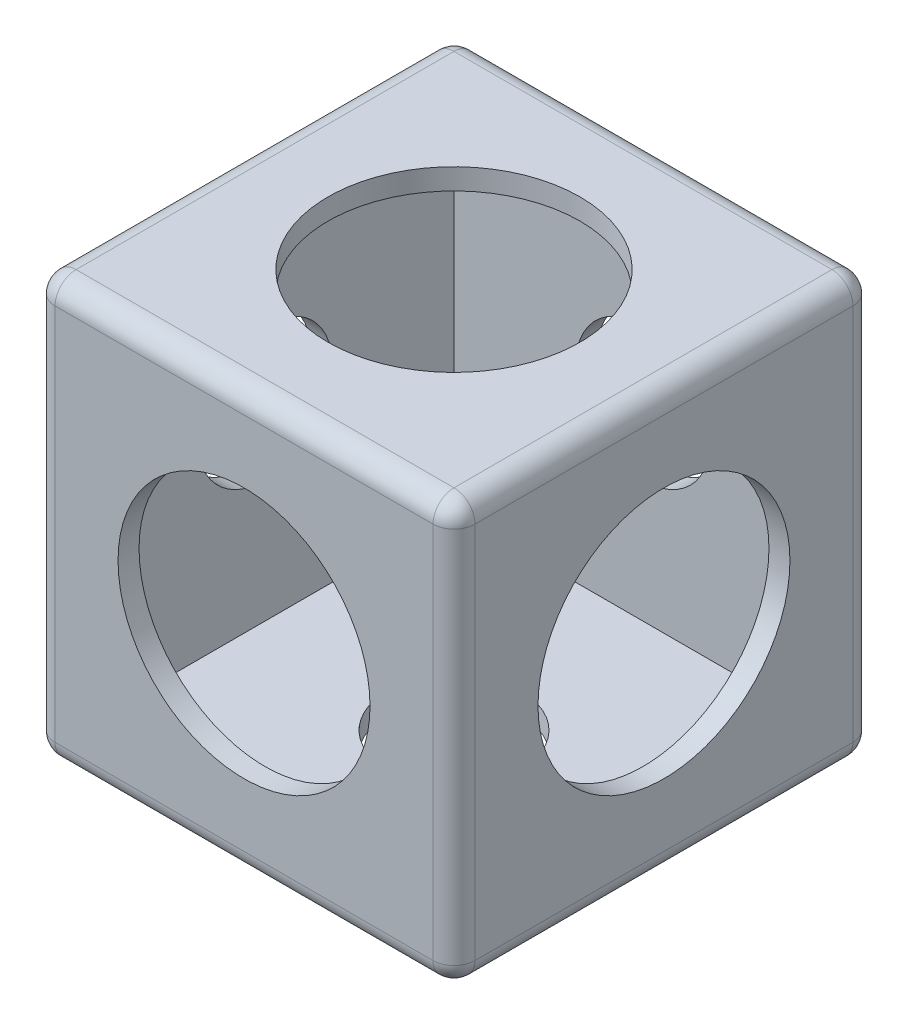
from build123d import *

# Parameters (mm, degrees)
SKETCH1_W           = 10
SKETCH1_H           = 10
SKETCH1_R           = 1.6
BOSS_EXTRUDE1_DEPTH = 0.5
SKETCH4_W           = 10
SKETCH4_H           = 10
SKETCH4_W_2         = 9
SKETCH4_H_2         = 9
BOSS_EXTRUDE2_DEPTH = 9
SKETCH5_W           = 10
SKETCH5_H           = 10
SKETCH5_R           = 3
BOSS_EXTRUDE3_DEPTH = 0.5
SKETCH6_R           = 3
CUT_EXTRUDE1_DEPTH  = 0.5
SKETCH7_R           = 3
CUT_EXTRUDE2_DEPTH  = 0.5
SKETCH8_R           = 1.6
CUT_EXTRUDE3_DEPTH  = 0.5
SKETCH9_R           = 1.6
CUT_EXTRUDE4_DEPTH  = 0.5
FILLET5_R           = 0.5


with BuildPart() as part:
    # Sketch1 → Boss-Extrude1 (new body)
    with BuildSketch(Plane(origin=(0, 0, 0), x_dir=(1, 0, 0), z_dir=(0, 1, 0))):
        with Locations((5, 5)):
            Rectangle(SKETCH1_W, SKETCH1_H)
        with Locations(Location((5, 5, 0), (0, 0, 270))):
            Circle(SKETCH1_R, mode=Mode.SUBTRACT)
    extrude(amount=BOSS_EXTRUDE1_DEPTH)

    # Sketch4 → Boss-Extrude2 (add)
    with BuildSketch(Plane(origin=(0, 0.5, 0), x_dir=(1, 0, 0), z_dir=(0, 1, 0))):
        with Locations((5, 5)):
            Rectangle(SKETCH4_W, SKETCH4_H)
        with Locations((5, 5)):
            Rectangle(SKETCH4_W_2, SKETCH4_H_2, mode=Mode.SUBTRACT)
    extrude(amount=BOSS_EXTRUDE2_DEPTH)

    # Sketch5 → Boss-Extrude3 (add)
    with BuildSketch(Plane(origin=(0, 9.5, 0), x_dir=(1, 0, 0), z_dir=(0, 1, 0))):
        with Locations((5, 5)):
            Rectangle(SKETCH5_W, SKETCH5_H)
        with Locations(Location((5, 5, 0), (0, 0, 270))):
            Circle(SKETCH5_R, mode=Mode.SUBTRACT)
    extrude(amount=BOSS_EXTRUDE3_DEPTH)

    # Sketch6 → Cut-Extrude1 (cut)
    with BuildSketch(Plane(origin=(10, 0, 0), x_dir=(0, 0, -1), z_dir=(1, 0, 0))):
        with Locations((5, 5)):
            Circle(SKETCH6_R)
    extrude(amount=-CUT_EXTRUDE1_DEPTH, mode=Mode.SUBTRACT)

    # Sketch7 → Cut-Extrude2 (cut)
    with BuildSketch(Plane.XY):
        with Locations((5, 5)):
            Circle(SKETCH7_R)
    extrude(amount=-CUT_EXTRUDE2_DEPTH, mode=Mode.SUBTRACT)

    # Sketch8 → Cut-Extrude3 (cut)
    with BuildSketch(Plane.ZY):
        with Locations((-5, 5)):
            Circle(SKETCH8_R)
    extrude(amount=-CUT_EXTRUDE3_DEPTH, mode=Mode.SUBTRACT)

    # Sketch9 → Cut-Extrude4 (cut)
    with BuildSketch(Plane(origin=(0, 0, -10), x_dir=(-1, 0, 0), z_dir=(0, 0, -1))):
        with Locations((-5, 5)):
            Circle(SKETCH9_R)
    extrude(amount=-CUT_EXTRUDE4_DEPTH, mode=Mode.SUBTRACT)

    # Fillet5
    fillet5_edges = [part.edges().sort_by_distance(p)[0] for p in [
        (0, 10, -5),
        (5, 10, 0),
        (10, 10, -5),
        (5, 10, -10),
        (5, 0, -10),
        (10, 0, -5),
        (5, 0, 0),
        (0, 0, -5),
        (0, 5, -10),
        (10, 5, -10),
        (10, 5, 0),
        (0, 5, 0),
    ]]
    fillet(fillet5_edges, radius=FILLET5_R)


solid = part.part
